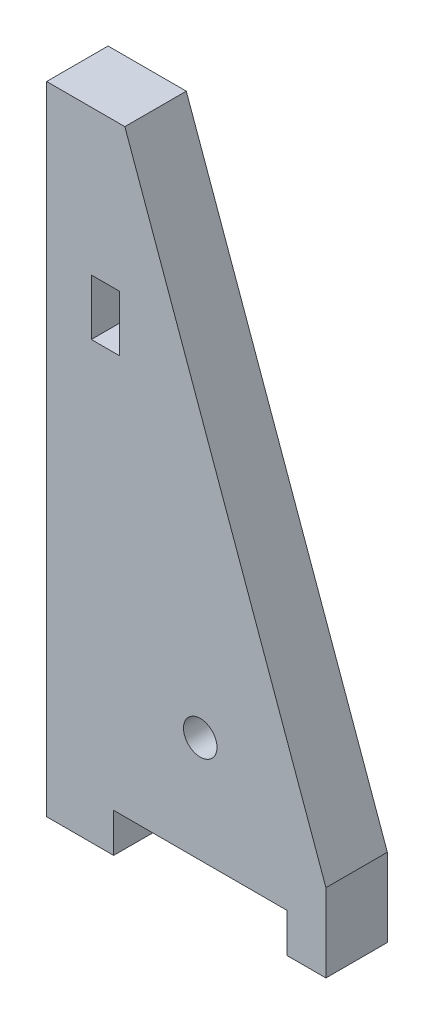
from build123d import *

# Parameters (mm, degrees)
SALIENTE_EXTRUIR1_DEPTH = 5.5
SALIENTE_EXTRUIR2_DEPTH = 5.5
CROQUIS3_W              = 15.5
CROQUIS3_H              = 3.5
CORTAR_EXTRUIR1_DEPTH   = 5.5
CROQUIS4_R              = 1.5
CORTAR_EXTRUIR2_DEPTH   = 5.5
CROQUIS5_W              = 2.5
CROQUIS5_H              = 5
CORTAR_EXTRUIR3_DEPTH   = 10


with BuildPart() as part:
    # Croquis1 → Saliente-Extruir1 (new body)
    with BuildSketch(Plane.XY):
        Polygon((0, 0), (0, -50), (25, -50), (25, -43), (7, -43), (7, 0), align=None)
    extrude(amount=SALIENTE_EXTRUIR1_DEPTH)

    # Croquis2 → Saliente-Extruir2 (add)
    with BuildSketch(Plane.XY.offset(5.5)):
        Polygon((25, -43), (0, -43), (0, 7), (7, 7), align=None)
    extrude(amount=-SALIENTE_EXTRUIR2_DEPTH)

    # Croquis3 → Cortar-Extruir1 (cut)
    with BuildSketch(Plane.XY.offset(5.5)):
        with Locations((13.75, -48.25)):
            Rectangle(CROQUIS3_W, CROQUIS3_H)
    extrude(amount=-CORTAR_EXTRUIR1_DEPTH, mode=Mode.SUBTRACT)

    # Croquis4 → Cortar-Extruir2 (cut)
    with BuildSketch(Plane.XY.offset(5.5)):
        with Locations((13.75, -37)):
            Circle(CROQUIS4_R)
    extrude(amount=-CORTAR_EXTRUIR2_DEPTH, mode=Mode.SUBTRACT)

    # Croquis5 → Cortar-Extruir3 (cut)
    with BuildSketch(Plane.XY.offset(5.5)):
        with Locations((5.25, -8.5)):
            Rectangle(CROQUIS5_W, CROQUIS5_H)
    extrude(amount=-CORTAR_EXTRUIR3_DEPTH, mode=Mode.SUBTRACT)


solid = part.part
